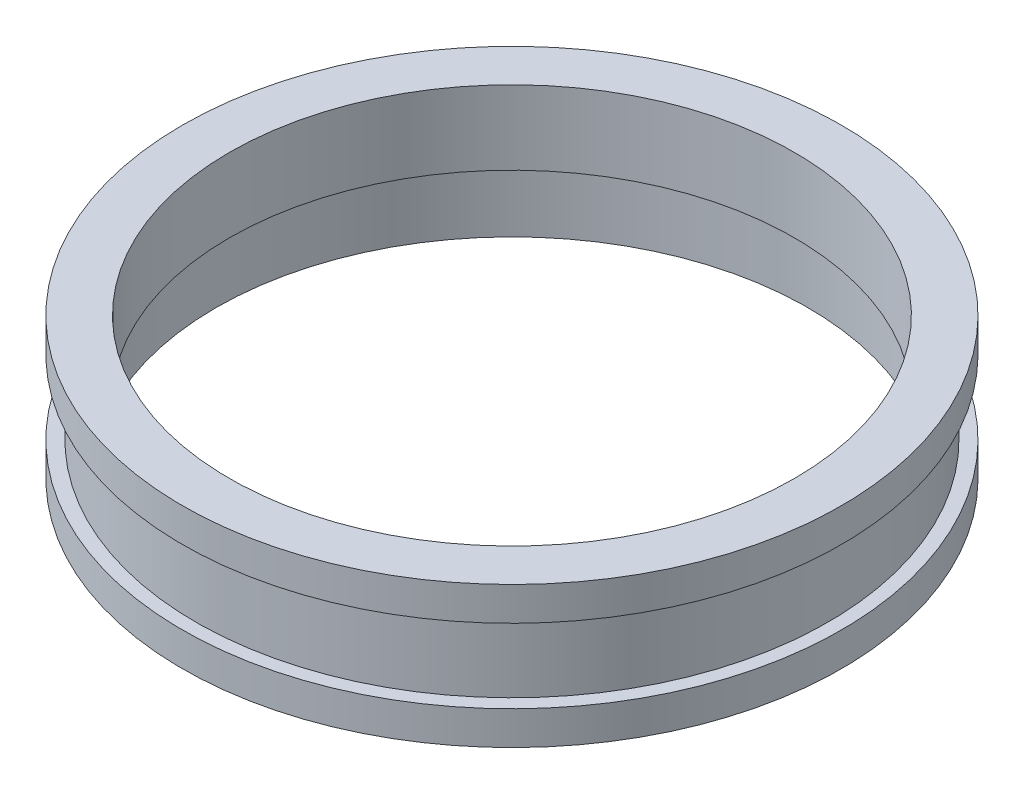
from build123d import *


with BuildPart() as part:
    # Sketch1 → Revolve1 (revolve)
    with BuildSketch(Plane.XY):
        Polygon((-49, 12), (-49, 17), (-47, 17), (-47, 28), (-49, 28), (-49, 33), (-42, 33), (-42, 22), (-44, 22), (-44, 12), align=None)
    revolve(axis=Axis((0, 15.855614973, 0), (0, -1, 0)))


solid = part.part
